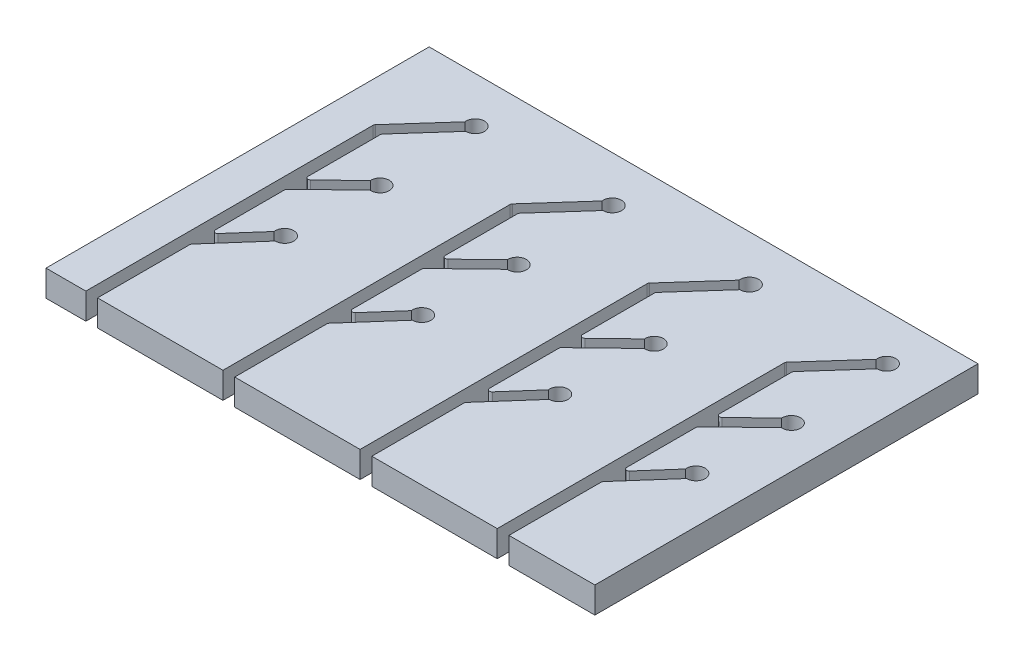
from build123d import *

# Parameters (mm, degrees)
BOSS_EXTRUDE1_DEPTH = 20


with BuildPart() as part:
    # Sketch1 → Boss-Extrude1 (new body)
    with BuildSketch(Plane(origin=(0, 10, 0), x_dir=(1, 0, 0), z_dir=(0, 1, 0))):
        with BuildLine():
            Line((324.62395369, 187.030739377), (-95.643756342, 187.030739377))
            Line((-95.643756342, 187.030739377), (-95.643756342, -106.347051638))
            Line((-95.643756342, -106.347051638), (-65.143756342, -106.347051638))
            Line((-65.143756342, -106.347051638), (-65.143756342, -33.38491726))
            Line((-65.143756342, -33.38491726), (-65.143756342, 39.577217118))
            Line((-65.143756342, 39.577217118), (-65.143756342, 113.493168526))
            ThreePointArc((-65.143756342, 113.493168526), (-65.012374488, 114.20609645), (-64.635490117, 114.825358582))
            Line((-64.635490117, 114.825358582), (-32.303983997, 151.028901364))
            ThreePointArc((-32.303983997, 151.028901364), (-25.878259507, 159.012700556), (-18.37604631, 152.030739377))
            ThreePointArc((-18.37604631, 152.030739377), (-20.50295437, 147.005505557), (-25.591182009, 145.034046113))
            Line((-25.591182009, 145.034046113), (-55.635490117, 111.391617273))
            ThreePointArc((-55.635490117, 111.391617273), (-56.012374488, 110.772355142), (-56.143756342, 110.059427218))
            Line((-56.143756342, 110.059427218), (-56.143756342, 54.882804578))
            ThreePointArc((-56.143756342, 54.882804578), (-54.925540994, 53.041931753), (-52.754943584, 53.443638458))
            Line((-52.754943584, 53.443638458), (-29.527180359, 75.858711639))
            ThreePointArc((-29.527180359, 75.858711639), (-22.786771169, 83.339716759), (-15.544017337, 76.34392727))
            ThreePointArc((-15.544017337, 76.34392727), (-17.860778034, 71.141305851), (-23.277522947, 69.382464097))
            Line((-23.277522947, 69.382464097), (-55.5325691, 38.255953421))
            ThreePointArc((-55.5325691, 38.255953421), (-55.984629167, 37.598571952), (-56.143756342, 36.816787301))
            Line((-56.143756342, 36.816787301), (-56.143756342, -16.173695516))
            ThreePointArc((-56.143756342, -16.173695516), (-54.850365584, -18.044712186), (-52.643052963, -17.495773188))
            Line((-52.643052963, -17.495773188), (-32.564764827, 5.295289321))
            ThreePointArc((-32.564764827, 5.295289321), (-26.169560776, 13.324151457), (-18.643756342, 6.34392727))
            ThreePointArc((-18.643756342, 6.34392727), (-20.753710482, 1.335189757), (-25.811599623, -0.6540602))
            Line((-25.811599623, -0.6540602), (-55.644459721, -34.517633364))
            ThreePointArc((-55.644459721, -34.517633364), (-56.014773012, -35.133101793), (-56.143756342, -35.839711035))
            Line((-56.143756342, -35.839711035), (-56.143756342, -106.347051638))
            Line((-56.143756342, -106.347051638), (39.856243658, -106.347051638))
            Line((39.856243658, -106.347051638), (39.856243658, -33.38491726))
            Line((39.856243658, -33.38491726), (39.856243658, 39.577217118))
            Line((39.856243658, 39.577217118), (39.856243658, 113.493168526))
            ThreePointArc((39.856243658, 113.493168526), (39.987625512, 114.20609645), (40.364509883, 114.825358582))
            Line((40.364509883, 114.825358582), (72.696016003, 151.028901364))
            ThreePointArc((72.696016003, 151.028901364), (79.121740493, 159.012700556), (86.62395369, 152.030739377))
            ThreePointArc((86.62395369, 152.030739377), (84.49704563, 147.005505557), (79.408817991, 145.034046113))
            Line((79.408817991, 145.034046113), (49.364509883, 111.391617273))
            ThreePointArc((49.364509883, 111.391617273), (48.987625512, 110.772355142), (48.856243658, 110.059427218))
            Line((48.856243658, 110.059427218), (48.856243658, 54.882804578))
            ThreePointArc((48.856243658, 54.882804578), (50.074459006, 53.041931753), (52.245056416, 53.443638458))
            Line((52.245056416, 53.443638458), (75.472819641, 75.858711639))
            ThreePointArc((75.472819641, 75.858711639), (82.213228831, 83.339716759), (89.455982663, 76.34392727))
            ThreePointArc((89.455982663, 76.34392727), (87.139221966, 71.141305851), (81.722477053, 69.382464097))
            Line((81.722477053, 69.382464097), (49.4674309, 38.255953421))
            ThreePointArc((49.4674309, 38.255953421), (49.015370833, 37.598571952), (48.856243658, 36.816787301))
            Line((48.856243658, 36.816787301), (48.856243658, -16.173695516))
            ThreePointArc((48.856243658, -16.173695516), (50.149634416, -18.044712186), (52.356947037, -17.495773188))
            Line((52.356947037, -17.495773188), (72.435235173, 5.295289321))
            ThreePointArc((72.435235173, 5.295289321), (78.830439224, 13.324151457), (86.356243658, 6.34392727))
            ThreePointArc((86.356243658, 6.34392727), (84.246289518, 1.335189757), (79.188400377, -0.6540602))
            Line((79.188400377, -0.6540602), (49.355540279, -34.517633364))
            ThreePointArc((49.355540279, -34.517633364), (48.985226988, -35.133101793), (48.856243658, -35.839711035))
            Line((48.856243658, -35.839711035), (48.856243658, -106.347051638))
            Line((48.856243658, -106.347051638), (144.856243658, -106.347051638))
            Line((144.856243658, -106.347051638), (144.856243658, -33.38491726))
            Line((144.856243658, -33.38491726), (144.856243658, 39.577217118))
            Line((144.856243658, 39.577217118), (144.856243658, 113.493168526))
            ThreePointArc((144.856243658, 113.493168526), (144.987625512, 114.20609645), (145.364509883, 114.825358582))
            Line((145.364509883, 114.825358582), (177.696016003, 151.028901364))
            ThreePointArc((177.696016003, 151.028901364), (184.121740493, 159.012700556), (191.62395369, 152.030739377))
            ThreePointArc((191.62395369, 152.030739377), (189.49704563, 147.005505557), (184.408817991, 145.034046113))
            Line((184.408817991, 145.034046113), (154.364509883, 111.391617273))
            ThreePointArc((154.364509883, 111.391617273), (153.987625512, 110.772355142), (153.856243658, 110.059427218))
            Line((153.856243658, 110.059427218), (153.856243658, 54.882804578))
            ThreePointArc((153.856243658, 54.882804578), (155.074459006, 53.041931753), (157.245056416, 53.443638458))
            Line((157.245056416, 53.443638458), (180.472819641, 75.858711639))
            ThreePointArc((180.472819641, 75.858711639), (187.213228831, 83.339716759), (194.455982663, 76.34392727))
            ThreePointArc((194.455982663, 76.34392727), (192.139221966, 71.141305851), (186.722477053, 69.382464097))
            Line((186.722477053, 69.382464097), (154.4674309, 38.255953421))
            ThreePointArc((154.4674309, 38.255953421), (154.015370833, 37.598571952), (153.856243658, 36.816787301))
            Line((153.856243658, 36.816787301), (153.856243658, -16.173695516))
            ThreePointArc((153.856243658, -16.173695516), (155.149634416, -18.044712186), (157.356947037, -17.495773188))
            Line((157.356947037, -17.495773188), (177.435235173, 5.295289321))
            ThreePointArc((177.435235173, 5.295289321), (183.830439224, 13.324151457), (191.356243658, 6.34392727))
            ThreePointArc((191.356243658, 6.34392727), (189.246289518, 1.335189757), (184.188400377, -0.6540602))
            Line((184.188400377, -0.6540602), (154.355540279, -34.517633364))
            ThreePointArc((154.355540279, -34.517633364), (153.985226988, -35.133101793), (153.856243658, -35.839711035))
            Line((153.856243658, -35.839711035), (153.856243658, -106.347051638))
            Line((153.856243658, -106.347051638), (249.856243658, -106.347051638))
            Line((249.856243658, -106.347051638), (249.856243658, -33.38491726))
            Line((249.856243658, -33.38491726), (249.856243658, 39.577217118))
            Line((249.856243658, 39.577217118), (249.856243658, 113.493168526))
            ThreePointArc((249.856243658, 113.493168526), (249.987625512, 114.20609645), (250.364509883, 114.825358582))
            Line((250.364509883, 114.825358582), (282.696016003, 151.028901364))
            ThreePointArc((282.696016003, 151.028901364), (289.121740493, 159.012700556), (296.62395369, 152.030739377))
            ThreePointArc((296.62395369, 152.030739377), (294.49704563, 147.005505557), (289.408817991, 145.034046113))
            Line((289.408817991, 145.034046113), (259.364509883, 111.391617273))
            ThreePointArc((259.364509883, 111.391617273), (258.987625512, 110.772355142), (258.856243658, 110.059427218))
            Line((258.856243658, 110.059427218), (258.856243658, 54.882804578))
            ThreePointArc((258.856243658, 54.882804578), (260.074459006, 53.041931753), (262.245056416, 53.443638458))
            Line((262.245056416, 53.443638458), (285.472819641, 75.858711639))
            ThreePointArc((285.472819641, 75.858711639), (292.213228831, 83.339716759), (299.455982663, 76.34392727))
            ThreePointArc((299.455982663, 76.34392727), (297.139221966, 71.141305851), (291.722477053, 69.382464097))
            Line((291.722477053, 69.382464097), (259.4674309, 38.255953421))
            ThreePointArc((259.4674309, 38.255953421), (259.015370833, 37.598571952), (258.856243658, 36.816787301))
            Line((258.856243658, 36.816787301), (258.856243658, -16.173695516))
            ThreePointArc((258.856243658, -16.173695516), (260.149634416, -18.044712186), (262.356947037, -17.495773188))
            Line((262.356947037, -17.495773188), (282.435235173, 5.295289321))
            ThreePointArc((282.435235173, 5.295289321), (288.830439224, 13.324151457), (296.356243658, 6.34392727))
            ThreePointArc((296.356243658, 6.34392727), (294.246289518, 1.335189757), (289.188400377, -0.6540602))
            Line((289.188400377, -0.6540602), (259.355540279, -34.517633364))
            ThreePointArc((259.355540279, -34.517633364), (258.985226988, -35.133101793), (258.856243658, -35.839711035))
            Line((258.856243658, -35.839711035), (258.856243658, -106.347051638))
            Line((258.856243658, -106.347051638), (324.62395369, -106.347051638))
            Line((324.62395369, -106.347051638), (324.62395369, 187.030739377))
        make_face()
    extrude(amount=BOSS_EXTRUDE1_DEPTH)


solid = part.part
